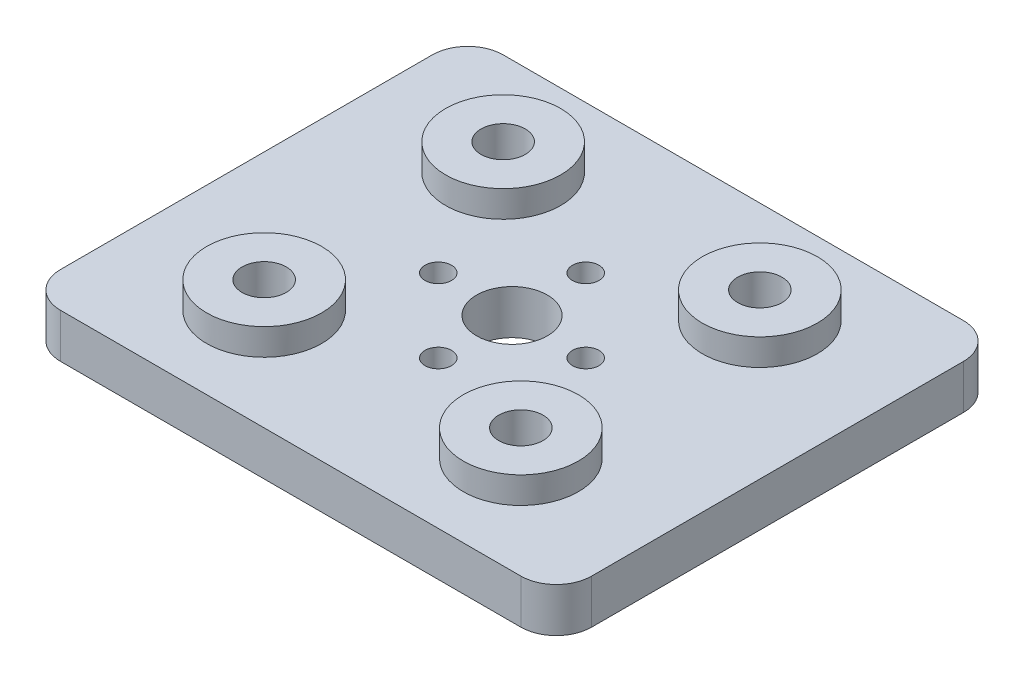
from build123d import *

# Parameters (mm, degrees)
SKETCH3_W            = 60
SKETCH3_H            = 50
SKETCH3_R            = 4
SKETCH3_R_2          = 1.5
BOSS_EXTRUDE1_DEPTH  = 5
SKETCH4_R            = 2.5
CUT_EXTRUDE1_DEPTH   = 5
FILLET1_R            = 4
BOSS_EXTRUDE2_START  = 3
SKETCH5_R            = 6.5
SKETCH5_R_2          = 2.5
BOSS_EXTRUDE2_DEPTH  = 3
LPATTERN1_COUNT      = 2
LPATTERN1_PITCH      = 29
LPATTERN1_COUNT_DIR2 = 2
LPATTERN1_PITCH_DIR2 = 27


with BuildPart() as part:
    # Sketch3 → Boss-Extrude1 (new body)
    with BuildSketch(Plane(origin=(0, 0, 0), x_dir=(1, 0, 0), z_dir=(0, 1, 0))):
        with Locations((19.268140366, 2.797796233)):
            Rectangle(SKETCH3_W, SKETCH3_H)
        with Locations(Location((19.268140366, 2.797796233, 0), (0, 0, 270))):
            Circle(SKETCH3_R, mode=Mode.SUBTRACT)
        with Locations(Location((10.938140366, 2.797796233, 0), (0, 0, 270))):
            Circle(SKETCH3_R_2, mode=Mode.SUBTRACT)
        with Locations(Location((19.268140366, 11.127796233, 0), (0, 0, 270))):
            Circle(SKETCH3_R_2, mode=Mode.SUBTRACT)
        with Locations(Location((27.598140366, 2.797796233, 0), (0, 0, 270))):
            Circle(SKETCH3_R_2, mode=Mode.SUBTRACT)
        with Locations(Location((19.268140366, -5.532203767, 0), (0, 0, 270))):
            Circle(SKETCH3_R_2, mode=Mode.SUBTRACT)
    extrude(amount=BOSS_EXTRUDE1_DEPTH)

    # Sketch4 → Cut-Extrude1 (cut)
    with BuildSketch(Plane(origin=(0, 5, 0), x_dir=(1, 0, 0), z_dir=(0, 1, 0))):
        with Locations(Location((4.768140366, 16.297796233, 0), (0, 0, 270))):
            Circle(SKETCH4_R)
        with Locations(Location((33.768140366, 16.297796233, 0), (0, 0, 270))):
            Circle(SKETCH4_R)
        with Locations(Location((33.768140366, -10.702203767, 0), (0, 0, 270))):
            Circle(SKETCH4_R)
        with Locations(Location((4.768140366, -10.702203767, 0), (0, 0, 270))):
            Circle(SKETCH4_R)
    extrude(amount=-CUT_EXTRUDE1_DEPTH, mode=Mode.SUBTRACT)

    # Fillet1
    fillet1_edges = [part.edges().sort_by_distance(p)[0] for p in [
        (-10.731859634, 2.5, -27.797796233),
        (49.268140366, 2.5, -27.797796233),
        (49.268140366, 2.5, 22.202203767),
        (-10.731859634, 2.5, 22.202203767),
    ]]
    fillet(fillet1_edges, radius=FILLET1_R)

    # Sketch5 → Boss-Extrude2 (add)
    with BuildSketch(Plane(origin=(0, 5, 0), x_dir=(1, 0, 0), z_dir=(0, 1, 0)).offset(BOSS_EXTRUDE2_START)):
        with Locations(Location((33.768140366, 16.297796233, 0), (0, 0, 90))):
            Circle(SKETCH5_R)
        with Locations(Location((33.768140366, 16.297796233, 0), (0, 0, 270))):
            Circle(SKETCH5_R_2, mode=Mode.SUBTRACT)
    boss_extrude2 = extrude(amount=-BOSS_EXTRUDE2_DEPTH)

    # LPattern1: Boss-Extrude2 2 × 2
    with Locations(*[(-i * LPATTERN1_PITCH, 0, j * LPATTERN1_PITCH_DIR2) for i in range(LPATTERN1_COUNT) for j in range(LPATTERN1_COUNT_DIR2) if (i, j) != (0, 0)]):
        add(boss_extrude2)


solid = part.part
